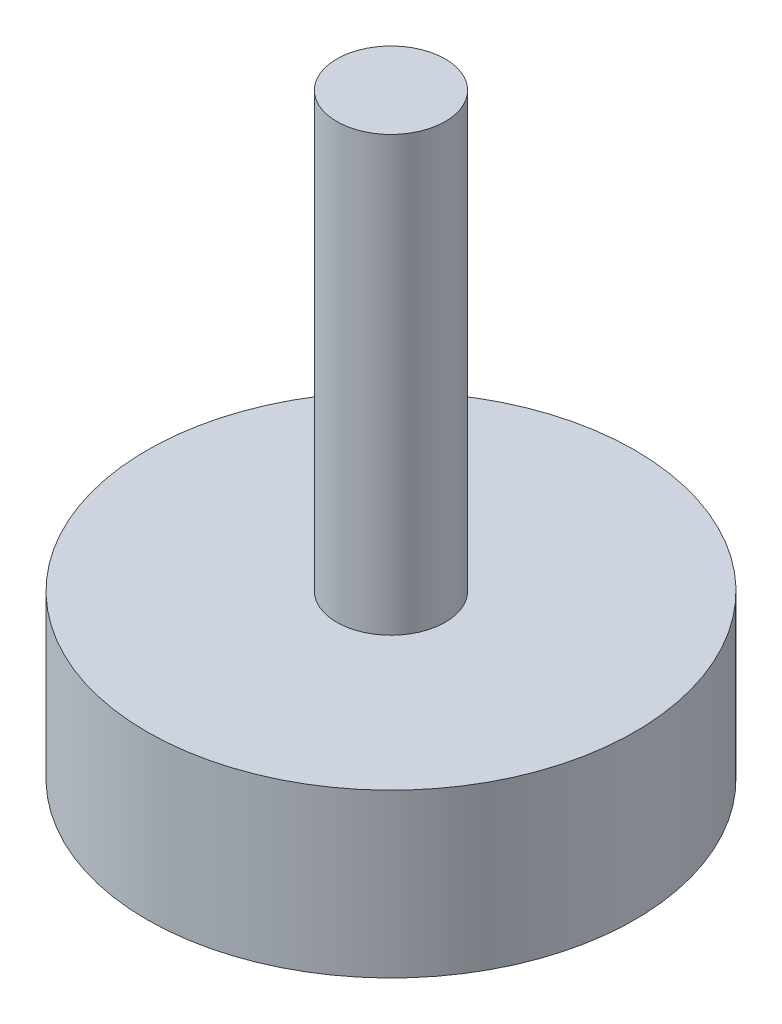
from build123d import *

# Parameters (mm, degrees)
SKETCH1_W = 3.175
SKETCH1_H = 25.4
SKETCH5_W = 14.2875
SKETCH5_H = 9.525


with BuildPart() as part:
    # Sketch1 → Revolve1 (revolve)
    with BuildSketch(Plane.XY, mode=Mode.PRIVATE) as revolve1_sk:
        with Locations((1.5875, 22.225)):
            Rectangle(SKETCH1_W, SKETCH1_H)
    revolve(revolve1_sk.sketch.rotate(Axis((0, 9.525, 0), (0, 1, 0)), 90), axis=Axis((0, 9.525, 0), (0, 1, 0)))

    # Sketch5 → Revolve2 (revolve)
    with BuildSketch(Plane.XY, mode=Mode.PRIVATE) as revolve2_sk:
        with Locations((7.14375, 4.7625)):
            Rectangle(SKETCH5_W, SKETCH5_H)
    revolve(revolve2_sk.sketch.rotate(Axis((0, 0, 0), (0, 1, 0)), 90), axis=Axis((0, 0, 0), (0, 1, 0)))


solid = part.part
